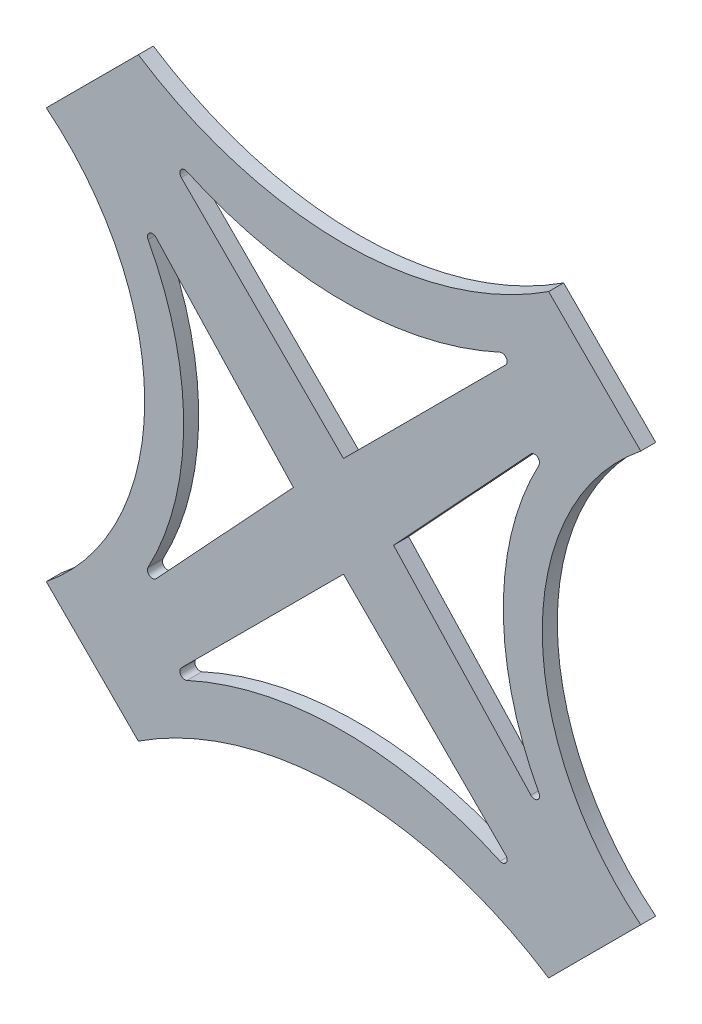
from build123d import *

# Parameters (mm, degrees)
SKETCH1_R             = 5
BOSS_EXTRUDE1_DEPTH   = 0.1
BOSS_EXTRUDE1_2_DEPTH = 0.1
BOSS_EXTRUDE1_3_DEPTH = 0.1
BOSS_EXTRUDE1_4_DEPTH = 0.1
BOSS_EXTRUDE2_DEPTH   = 3


with BuildPart() as part:
    # Sketch1 → Boss-Extrude1 (new body)
    with BuildSketch(Plane.XY):
        with Locations((-44.491847198, 44.491847198)):
            Circle(SKETCH1_R)
    extrude(amount=BOSS_EXTRUDE1_DEPTH)



with BuildPart() as body_2:
    # Sketch1 → Boss-Extrude1 2 (new body)
    with BuildSketch(Plane.XY):
        with Locations((44.491847198, 44.491847198)):
            Circle(SKETCH1_R)
    extrude(amount=BOSS_EXTRUDE1_2_DEPTH)


with BuildPart() as body_3:
    # Sketch1 → Boss-Extrude1 3 (new body)
    with BuildSketch(Plane.XY):
        with Locations((44.491847198, -44.491847198)):
            Circle(SKETCH1_R)
    extrude(amount=BOSS_EXTRUDE1_3_DEPTH)


with BuildPart() as body_4:
    # Sketch1 → Boss-Extrude1 4 (new body)
    with BuildSketch(Plane.XY):
        with Locations((-44.491847198, -44.491847198)):
            Circle(SKETCH1_R)
    extrude(amount=BOSS_EXTRUDE1_4_DEPTH)


with BuildPart() as part_1:
    add(part.part)

    add(body_2.part)  # Boss-Extrude2 merges body 2

    add(body_3.part)  # Boss-Extrude2 merges body 3

    add(body_4.part)  # Boss-Extrude2 merges body 4
    # Sketch2 → Boss-Extrude2 (add)
    with BuildSketch(Plane.XY):
        with BuildLine():
            Line((-59.341089603, 40.956313292), (-40.956313292, 59.341089603))
            ThreePointArc((-40.956313292, 59.341089603), (0, 47.170862812), (40.956313292, 59.341089603))
            Line((40.956313292, 59.341089603), (59.341089603, 40.956313292))
            ThreePointArc((59.341089603, 40.956313292), (39.686643359, 0), (59.341089603, -40.956313292))
            Line((59.341089603, -40.956313292), (40.956313292, -59.341089603))
            ThreePointArc((40.956313292, -59.341089603), (0, -47.170862812), (-40.956313292, -59.341089603))
            Line((-40.956313292, -59.341089603), (-59.341089603, -40.956313292))
            ThreePointArc((-59.341089603, -40.956313292), (-39.686643359, 0), (-59.341089603, 40.956313292))
        make_face()
        with BuildLine():
            Line((-32.376492153, 42.376492153), (0, 10))
            Line((0, 10), (32.376492153, 42.376492153))
            ThreePointArc((32.376492153, 42.376492153), (32.490402214, 43.654502905), (31.252682932, 43.99264188))
            ThreePointArc((31.252682932, 43.99264188), (0, 37.170862812), (-31.252682932, 43.99264188))
            ThreePointArc((-31.252682932, 43.99264188), (-32.490402214, 43.654502905), (-32.376492153, 42.376492153))
        make_face(mode=Mode.SUBTRACT)
        with BuildLine():
            Line((-37.410135101, 29.495739933), (-10, 0))
            Line((-10, 0), (-37.410135101, -29.495739933))
            ThreePointArc((-37.410135101, -29.495739933), (-38.724006049, -29.628666123), (-39.024062115, -28.342628566))
            ThreePointArc((-39.024062115, -28.342628566), (-31.907853639, 0), (-39.024062115, 28.342628566))
            ThreePointArc((-39.024062115, 28.342628566), (-38.724006049, 29.628666123), (-37.410135101, 29.495739933))
        make_face(mode=Mode.SUBTRACT)
        with BuildLine():
            Line((10, 0), (37.410135101, -29.495739933))
            ThreePointArc((37.410135101, -29.495739933), (38.724006049, -29.628666123), (39.024062115, -28.342628566))
            ThreePointArc((39.024062115, -28.342628566), (31.907853639, 0), (39.024062115, 28.342628566))
            ThreePointArc((39.024062115, 28.342628566), (38.724006049, 29.628666123), (37.410135101, 29.495739933))
            Line((37.410135101, 29.495739933), (10, 0))
        make_face(mode=Mode.SUBTRACT)
        with BuildLine():
            Line((0, -10), (32.376492153, -42.376492153))
            ThreePointArc((32.376492153, -42.376492153), (32.490402214, -43.654502905), (31.252682932, -43.99264188))
            ThreePointArc((31.252682932, -43.99264188), (0, -37.170862812), (-31.252682932, -43.99264188))
            ThreePointArc((-31.252682932, -43.99264188), (-32.490402214, -43.654502905), (-32.376492153, -42.376492153))
            Line((-32.376492153, -42.376492153), (0, -10))
        make_face(mode=Mode.SUBTRACT)
    extrude(amount=BOSS_EXTRUDE2_DEPTH)


solid = part_1.part
